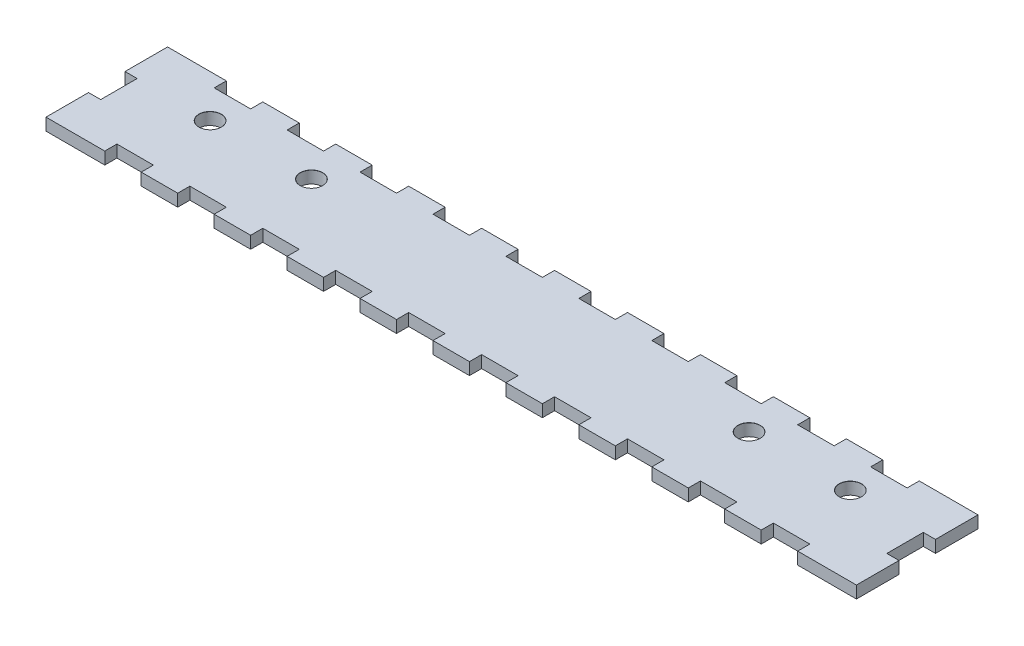
from build123d import *

# Parameters (mm, degrees)
BOSS_EXTRUDE1_DEPTH            = 1.5
M5_CLEARANCE_HOLE1_D           = 5.5
M5_CLEARANCE_HOLE1_CSINK_D     = 5.55
M5_CLEARANCE_HOLE1_CSINK_ANGLE = 90


with BuildPart() as part:
    # Sketch1 → Boss-Extrude1 (new, symmetric)
    with BuildSketch(Plane(origin=(0, 0, 0), x_dir=(1, 0, 0), z_dir=(0, 1, 0))):
        Polygon((100, 15), (97, 15), (85.5, 15), (85.5, 12), (76.5, 12), (76.5, 15), (67.5, 15), (67.5, 12), (58.5, 12), (58.5, 15), (49.5, 15), (49.5, 12), (40.5, 12), (40.5, 15), (31.5, 15), (31.5, 12), (22.5, 12), (22.5, 15), (13.5, 15), (13.5, 12), (4.5, 12), (4.5, 15), (-4.5, 15), (-4.5, 12), (-13.5, 12), (-13.5, 15), (-22.5, 15), (-22.5, 12), (-31.5, 12), (-31.5, 15), (-40.5, 15), (-40.5, 12), (-49.5, 12), (-49.5, 15), (-58.5, 15), (-58.5, 12), (-67.5, 12), (-67.5, 15), (-76.5, 15), (-76.5, 12), (-85.5, 12), (-85.5, 15), (-97, 15), (-100, 15), (-100, 12), (-100, 4.5), (-97, 4.5), (-97, -4.5), (-100, -4.5), (-100, -12), (-100, -15), (-97, -15), (-85.5, -15), (-85.5, -12), (-76.5, -12), (-76.5, -15), (-67.5, -15), (-67.5, -12), (-58.5, -12), (-58.5, -15), (-49.5, -15), (-49.5, -12), (-40.5, -12), (-40.5, -15), (-31.5, -15), (-31.5, -12), (-22.5, -12), (-22.5, -15), (-13.5, -15), (-13.5, -12), (-4.5, -12), (-4.5, -15), (4.5, -15), (4.5, -12), (13.5, -12), (13.5, -15), (22.5, -15), (22.5, -12), (31.5, -12), (31.5, -15), (40.5, -15), (40.5, -12), (49.5, -12), (49.5, -15), (58.5, -15), (58.5, -12), (67.5, -12), (67.5, -15), (76.5, -15), (76.5, -12), (85.5, -12), (85.5, -15), (97, -15), (100, -15), (100, -12), (100, -4.5), (97, -4.5), (97, 4.5), (100, 4.5), (100, 12), align=None)
    extrude(amount=BOSS_EXTRUDE1_DEPTH, both=True)

    # M5 Clearance Hole1 (through all)
    with Locations(Plane(origin=(0, 1.5, 0), x_dir=(1, 0, 0), z_dir=(0, 1, 0))):
        with Locations((54, 4.5), (-79, 4.5), (-54, 4.5), (79, 4.5)):
            CounterSinkHole(M5_CLEARANCE_HOLE1_D / 2, M5_CLEARANCE_HOLE1_CSINK_D / 2, counter_sink_angle=M5_CLEARANCE_HOLE1_CSINK_ANGLE)


solid = part.part
